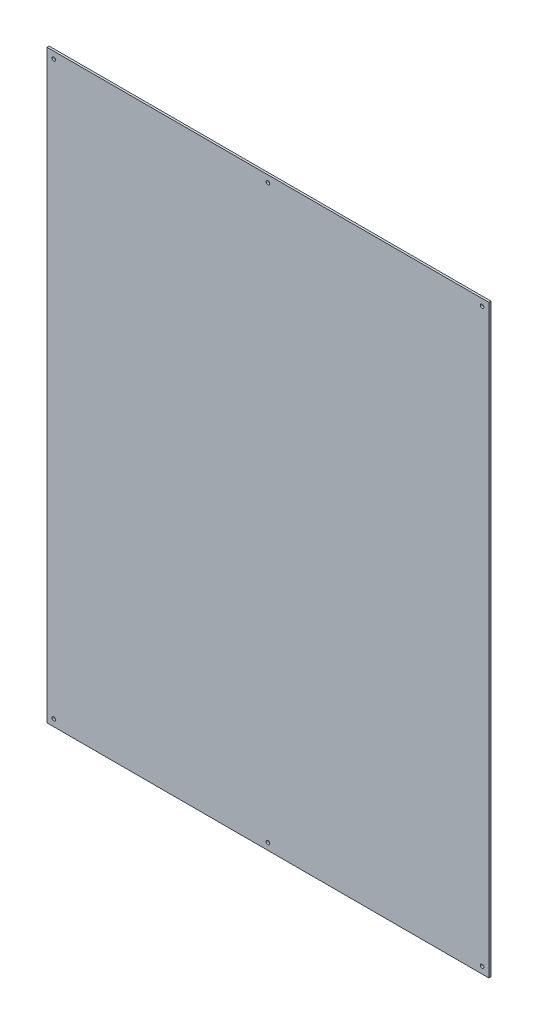
from build123d import *

# Parameters (mm, degrees)
SKETCH1_W           = 648
SKETCH1_H           = 858
BOSS_EXTRUDE1_DEPTH = 3.175
CUT_EXTRUDE1_REACH  = 1077.211
SKETCH2_R           = 2.61


with BuildPart() as part:
    # Sketch1 → Boss-Extrude1 (new body)
    with BuildSketch(Plane.XY):
        with Locations((324, -429)):
            Rectangle(SKETCH1_W, SKETCH1_H)
    extrude(amount=BOSS_EXTRUDE1_DEPTH)

    # Sketch2 → Cut-Extrude1 (cut, up to next)
    with BuildSketch(Plane.XY.offset(3.175), mode=Mode.PRIVATE) as cut_extrude1_sk1:
        with Locations((10, -848)):
            Circle(SKETCH2_R)
    cut_extrude1_tool1 = extrude(cut_extrude1_sk1.sketch, amount=-CUT_EXTRUDE1_REACH, mode=Mode.PRIVATE) & part.part
    # Sketch2 → Cut-Extrude1 (cut, up to next)
    with BuildSketch(Plane.XY.offset(3.175), mode=Mode.PRIVATE) as cut_extrude1_sk2:
        with Locations((324, -848)):
            Circle(SKETCH2_R)
    cut_extrude1_tool2 = extrude(cut_extrude1_sk2.sketch, amount=-CUT_EXTRUDE1_REACH, mode=Mode.PRIVATE) & part.part
    # Sketch2 → Cut-Extrude1 (cut, up to next)
    with BuildSketch(Plane.XY.offset(3.175), mode=Mode.PRIVATE) as cut_extrude1_sk3:
        with Locations((638, -848)):
            Circle(SKETCH2_R)
    cut_extrude1_tool3 = extrude(cut_extrude1_sk3.sketch, amount=-CUT_EXTRUDE1_REACH, mode=Mode.PRIVATE) & part.part
    # Sketch2 → Cut-Extrude1 (cut, up to next)
    with BuildSketch(Plane.XY.offset(3.175), mode=Mode.PRIVATE) as cut_extrude1_sk4:
        with Locations((638, -10)):
            Circle(SKETCH2_R)
    cut_extrude1_tool4 = extrude(cut_extrude1_sk4.sketch, amount=-CUT_EXTRUDE1_REACH, mode=Mode.PRIVATE) & part.part
    # Sketch2 → Cut-Extrude1 (cut, up to next)
    with BuildSketch(Plane.XY.offset(3.175), mode=Mode.PRIVATE) as cut_extrude1_sk5:
        with Locations((324, -10)):
            Circle(SKETCH2_R)
    cut_extrude1_tool5 = extrude(cut_extrude1_sk5.sketch, amount=-CUT_EXTRUDE1_REACH, mode=Mode.PRIVATE) & part.part
    # Sketch2 → Cut-Extrude1 (cut, up to next)
    with BuildSketch(Plane.XY.offset(3.175), mode=Mode.PRIVATE) as cut_extrude1_sk6:
        with Locations((10, -10)):
            Circle(SKETCH2_R)
    cut_extrude1_tool6 = extrude(cut_extrude1_sk6.sketch, amount=-CUT_EXTRUDE1_REACH, mode=Mode.PRIVATE) & part.part
    add(cut_extrude1_tool1.solids().sort_by_distance((10, -848, 3.175))[0], mode=Mode.SUBTRACT)
    add(cut_extrude1_tool2.solids().sort_by_distance((324, -848, 3.175))[0], mode=Mode.SUBTRACT)
    add(cut_extrude1_tool3.solids().sort_by_distance((638, -848, 3.175))[0], mode=Mode.SUBTRACT)
    add(cut_extrude1_tool4.solids().sort_by_distance((638, -10, 3.175))[0], mode=Mode.SUBTRACT)
    add(cut_extrude1_tool5.solids().sort_by_distance((324, -10, 3.175))[0], mode=Mode.SUBTRACT)
    add(cut_extrude1_tool6.solids().sort_by_distance((10, -10, 3.175))[0], mode=Mode.SUBTRACT)


solid = part.part
